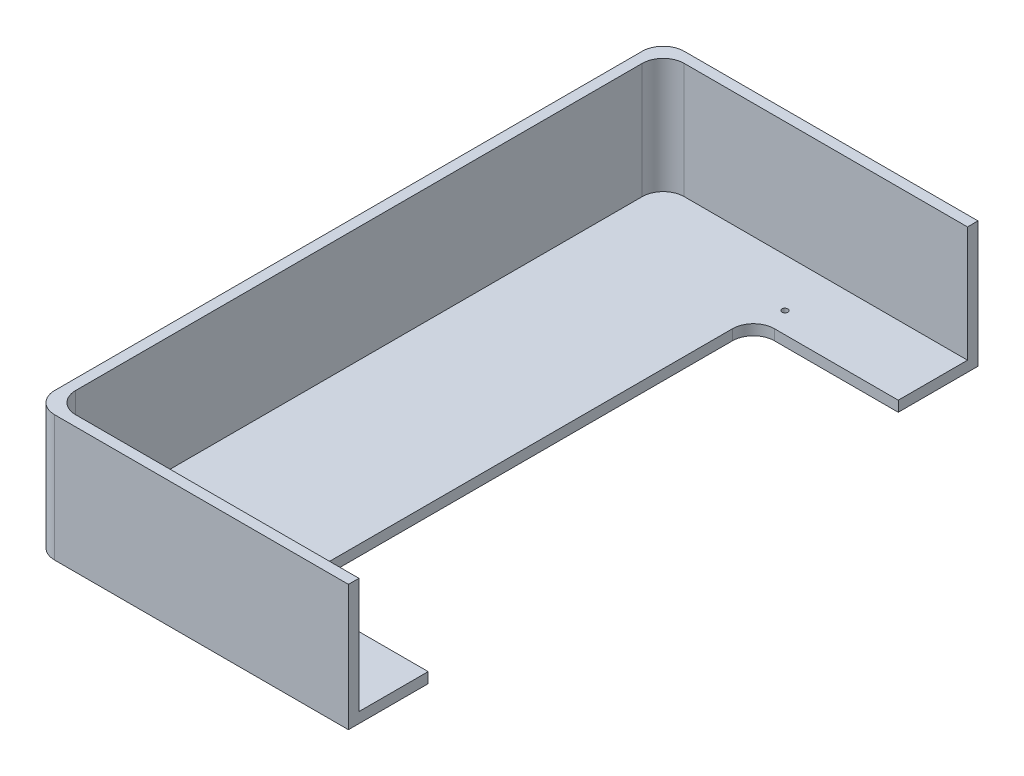
from build123d import *

# Parameters (mm, degrees)
SKETCH_1_W          = 150
SKETCH_1_H          = 300
EXTRUDE_1_DEPTH     = 60
CUT_EXTRUDE_1_DEPTH = 55
SKETCH_3_W          = 69
SKETCH_3_H          = 224
CUT_EXTRUDE_2_DEPTH = 5
SKETCH_4_R          = 1.4
CUT_EXTRUDE_3_DEPTH = 5
FILLET_1_R          = 10


with BuildPart() as part:
    # 草图1 → 凸台-拉伸1 (new body)
    with BuildSketch(Plane(origin=(0, 0, 0), x_dir=(1, 0, 0), z_dir=(0, 1, 0))):
        with Locations((-75, -150)):
            Rectangle(SKETCH_1_W, SKETCH_1_H)
    extrude(amount=EXTRUDE_1_DEPTH)

    # 草图2 → 切除-拉伸1 (cut)
    with BuildSketch(Plane(origin=(0, 60, 0), x_dir=(1, 0, 0), z_dir=(0, 1, 0))):
        Polygon((-5, -5), (-145, -5), (-145, -295), (-5, -295), (0, -295), (0, -5), align=None)
    extrude(amount=-CUT_EXTRUDE_1_DEPTH, mode=Mode.SUBTRACT)

    # 草图3 → 切除-拉伸2 (cut)
    with BuildSketch(Plane(origin=(0, 5, 0), x_dir=(1, 0, 0), z_dir=(0, 1, 0))):
        with Locations((-34.5, -150)):
            Rectangle(SKETCH_3_W, SKETCH_3_H)
    extrude(amount=-CUT_EXTRUDE_2_DEPTH, mode=Mode.SUBTRACT)

    # 草图4 → 切除-拉伸3 (cut)
    with BuildSketch(Plane(origin=(0, 5, 0), x_dir=(1, 0, 0), z_dir=(0, 1, 0))):
        with Locations(Location((-64, -28, 0), (0, 0, 270))):
            Circle(SKETCH_4_R)
        with Locations(Location((-64, -272, 0), (0, 0, 90))):
            Circle(SKETCH_4_R)
    extrude(amount=-CUT_EXTRUDE_3_DEPTH, mode=Mode.SUBTRACT)

    # 圆角1
    fillet_1_edges = [part.edges().sort_by_distance(p)[0] for p in [
        (-145, 32.5, 5),
        (-145, 32.5, 295),
        (-69, 2.5, 38),
        (-69, 2.5, 262),
        (-150, 30, 300),
        (-150, 30, 0),
    ]]
    fillet(fillet_1_edges, radius=FILLET_1_R)


solid = part.part
